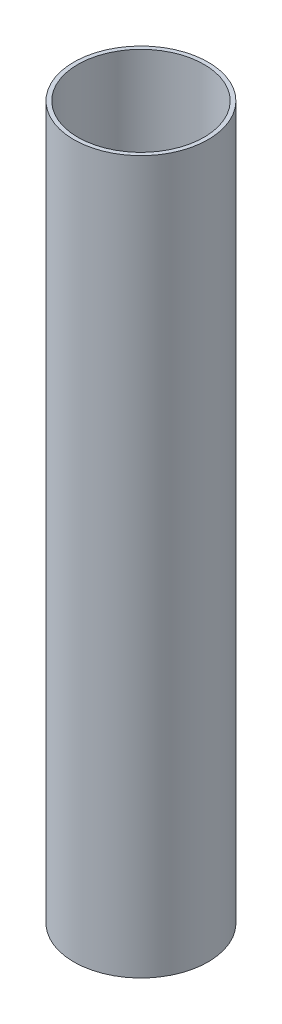
from build123d import *

# Parameters (mm, degrees)
SKETCH1_R           = 20.75
SKETCH1_R_2         = 19.5
BOSS_EXTRUDE1_DEPTH = 220


with BuildPart() as part:
    # Sketch1 → Boss-Extrude1 (new body)
    with BuildSketch(Plane(origin=(0, 0, 0), x_dir=(1, 0, 0), z_dir=(0, 1, 0))):
        with Locations(Location((0, 0, 0), (0, 0, 270))):
            Circle(SKETCH1_R)
        with Locations(Location((0, 0, 0), (0, 0, 270))):
            Circle(SKETCH1_R_2, mode=Mode.SUBTRACT)
    extrude(amount=BOSS_EXTRUDE1_DEPTH)


solid = part.part
